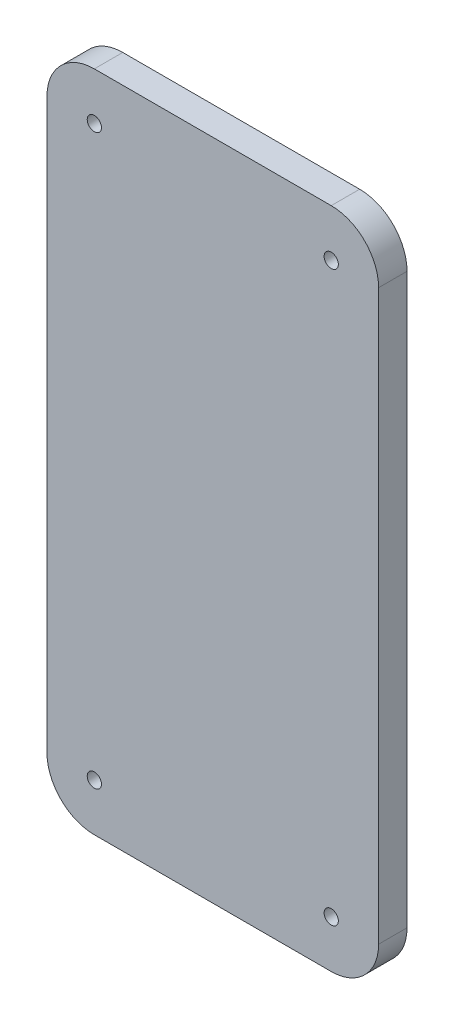
from build123d import *

# Parameters (mm, degrees)
SKETCH1_W           = 70
SKETCH1_H           = 140
BOSS_EXTRUDE1_DEPTH = 6
FILLET1_R           = 10
SKETCH2_R           = 1.5
CUT_EXTRUDE1_DEPTH  = 6


with BuildPart() as part:
    # Sketch1 → Boss-Extrude1 (new body)
    with BuildSketch(Plane.XY):
        Rectangle(SKETCH1_W, SKETCH1_H)
    extrude(amount=BOSS_EXTRUDE1_DEPTH)

    # Fillet1
    fillet1_edges = [part.edges().sort_by_distance(p)[0] for p in [
        (-35, 70, 3),
        (35, 70, 3),
        (35, -70, 3),
        (-35, -70, 3),
    ]]
    fillet(fillet1_edges, radius=FILLET1_R)

    # Sketch2 → Cut-Extrude1 (cut)
    with BuildSketch(Plane.XY.offset(6)):
        with Locations((-25, 60)):
            Circle(SKETCH2_R)
        with Locations((25, 60)):
            Circle(SKETCH2_R)
        with Locations((25, -60)):
            Circle(SKETCH2_R)
        with Locations((-25, -60)):
            Circle(SKETCH2_R)
    extrude(amount=-CUT_EXTRUDE1_DEPTH, mode=Mode.SUBTRACT)


solid = part.part
